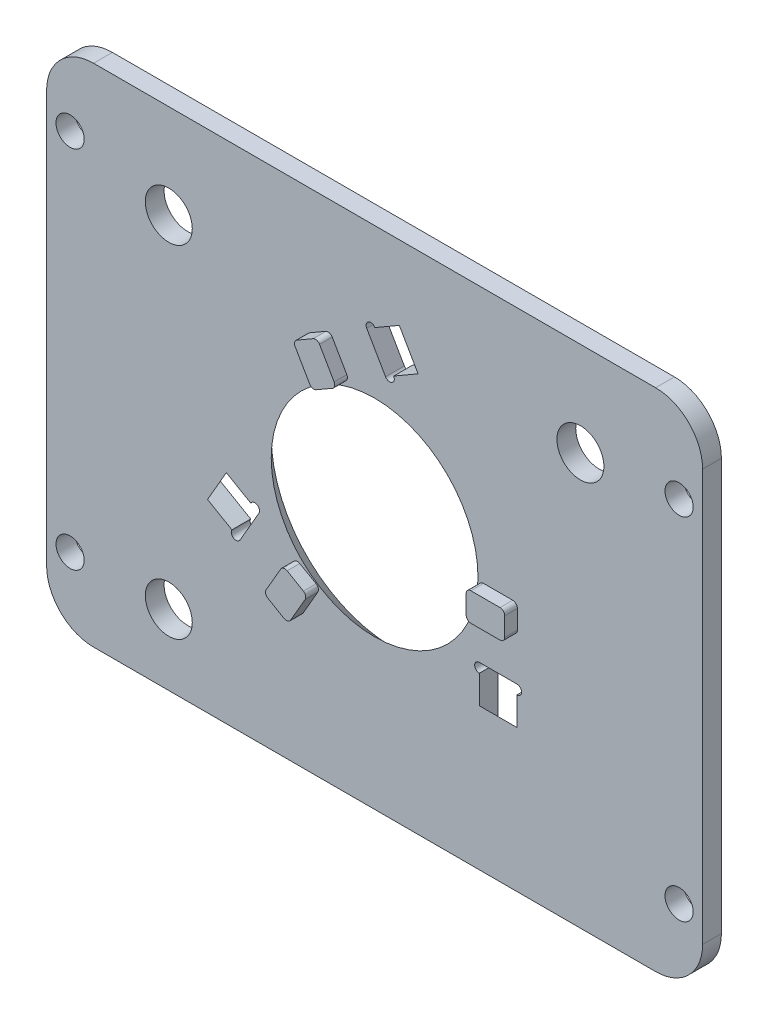
from build123d import *

# Parameters (mm, degrees)
SKETCH_1_W          = 76
SKETCH_1_H          = 60
EXTRUDE_1_DEPTH     = 2
EXTRUDE_2_DEPTH     = 3.35
SKETCH_2_W          = 76
SKETCH_2_H          = 60
CUT_EXTRUDE_1_DEPTH = 2.95
SKETCH_3_R          = 1.715
CUT_EXTRUDE_2_DEPTH = 10
SKETCH_5_R          = 1.5
CUT_EXTRUDE_3_DEPTH = 45.193605611
SKETCH_6_R          = 2.5
CUT_EXTRUDE_4_DEPTH = 45.111815616
CUT_EXTRUDE_5_DEPTH = 4
CUT_EXTRUDE_6_DEPTH = 4
CUT_EXTRUDE_7_DEPTH = 4


with BuildPart() as part:
    # 草圖1 → 填料-伸長1 (new body)
    with BuildSketch(Plane.XY):
        Rectangle(SKETCH_1_W, SKETCH_1_H)
        with BuildLine():
            Line((-6.042909564, -9.905650781), (-7.592909564, -12.590329533))
            ThreePointArc((-7.592909564, -12.590329533), (-7.896512744, -12.823292446), (-8.275922266, -12.773342235))
            Line((-8.275922266, -12.773342235), (-10.007973074, -11.773342235))
            ThreePointArc((-10.007973074, -11.773342235), (-10.240935987, -11.469739056), (-10.190985776, -11.090329533))
            Line((-10.190985776, -11.090329533), (-8.640985776, -8.405650781))
            ThreePointArc((-8.640985776, -8.405650781), (-8.337382596, -8.172687868), (-7.957973074, -8.22263808))
            Line((-7.957973074, -8.22263808), (-6.225922266, -9.22263808))
            ThreePointArc((-6.225922266, -9.22263808), (-5.992959353, -9.526241259), (-6.042909564, -9.905650781))
        make_face(mode=Mode.SUBTRACT)
        with BuildLine():
            ThreePointArc((-14.313100093, -9.230040965), (-14.996112795, -9.413053667), (-15.179125497, -8.730040965))
            Line((-15.179125497, -8.730040965), (-13.179125497, -5.26593935))
            ThreePointArc((-13.179125497, -5.26593935), (-12.496112795, -5.082926648), (-12.313100093, -5.76593935))
            Line((-12.313100093, -5.76593935), (-14.313100093, -9.230040965))
        make_face(mode=Mode.SUBTRACT)
        with BuildLine():
            ThreePointArc((11.146484837, -8.780487805), (10.646484837, -8.280487805), (11.146484837, -7.780487805))
            Line((11.146484837, -7.780487805), (15.146484837, -7.780487805))
            ThreePointArc((15.146484837, -7.780487805), (15.646484837, -8.280487805), (15.146484837, -8.780487805))
            Line((15.146484837, -8.780487805), (11.146484837, -8.780487805))
        make_face(mode=Mode.SUBTRACT)
        with BuildLine():
            Line((-5.557090436, 10.186138586), (-7.107090436, 12.870817338))
            ThreePointArc((-7.107090436, 12.870817338), (-7.157040647, 13.250226861), (-6.924077734, 13.55383004))
            Line((-6.924077734, 13.55383004), (-5.192026926, 14.55383004))
            ThreePointArc((-5.192026926, 14.55383004), (-4.812617404, 14.603780251), (-4.509014224, 14.370817338))
            Line((-4.509014224, 14.370817338), (-2.959014224, 11.686138586))
            ThreePointArc((-2.959014224, 11.686138586), (-2.909064013, 11.306729064), (-3.142026926, 11.003125884))
            Line((-3.142026926, 11.003125884), (-4.874077734, 10.003125884))
            ThreePointArc((-4.874077734, 10.003125884), (-5.253487256, 9.953175673), (-5.557090436, 10.186138586))
        make_face(mode=Mode.SUBTRACT)
        with BuildLine():
            Line((1.163100093, 13.546427155), (-0.836899907, 17.01052877))
            ThreePointArc((-0.836899907, 17.01052877), (-0.653887205, 17.693541472), (0.029125497, 17.51052877))
            Line((0.029125497, 17.51052877), (2.029125497, 14.046427155))
            ThreePointArc((2.029125497, 14.046427155), (1.846112795, 13.363414453), (1.163100093, 13.546427155))
        make_face(mode=Mode.SUBTRACT)
    extrude(amount=EXTRUDE_1_DEPTH)

    # 草圖1<3> → 填料-伸長2 (add)
    with BuildSketch(Plane.XY):
        with BuildLine():
            Line((14.696484837, -0.280487805), (11.596484837, -0.280487805))
            ThreePointArc((11.596484837, -0.280487805), (11.242931447, -0.426934414), (11.096484837, -0.780487805))
            Line((11.096484837, -0.780487805), (11.096484837, -2.780487805))
            ThreePointArc((11.096484837, -2.780487805), (11.242931447, -3.134041195), (11.596484837, -3.280487805))
            Line((11.596484837, -3.280487805), (14.696484837, -3.280487805))
            ThreePointArc((14.696484837, -3.280487805), (15.050038228, -3.134041195), (15.196484837, -2.780487805))
            Line((15.196484837, -2.780487805), (15.196484837, -0.780487805))
            ThreePointArc((15.196484837, -0.780487805), (15.050038228, -0.426934414), (14.696484837, -0.280487805))
        make_face()
        with BuildLine():
            Line((-7.592909564, -12.590329533), (-6.042909564, -9.905650781))
            ThreePointArc((-6.042909564, -9.905650781), (-5.992959353, -9.526241259), (-6.225922266, -9.22263808))
            Line((-6.225922266, -9.22263808), (-7.957973074, -8.22263808))
            ThreePointArc((-7.957973074, -8.22263808), (-8.337382596, -8.172687868), (-8.640985776, -8.405650781))
            Line((-8.640985776, -8.405650781), (-10.190985776, -11.090329533))
            ThreePointArc((-10.190985776, -11.090329533), (-10.240935987, -11.469739056), (-10.007973074, -11.773342235))
            Line((-10.007973074, -11.773342235), (-8.275922266, -12.773342235))
            ThreePointArc((-8.275922266, -12.773342235), (-7.896512744, -12.823292446), (-7.592909564, -12.590329533))
        make_face()
        with BuildLine():
            Line((-7.107090436, 12.870817338), (-5.557090436, 10.186138586))
            ThreePointArc((-5.557090436, 10.186138586), (-5.253487256, 9.953175673), (-4.874077734, 10.003125884))
            Line((-4.874077734, 10.003125884), (-3.142026926, 11.003125884))
            ThreePointArc((-3.142026926, 11.003125884), (-2.909064013, 11.306729064), (-2.959014224, 11.686138586))
            Line((-2.959014224, 11.686138586), (-4.509014224, 14.370817338))
            ThreePointArc((-4.509014224, 14.370817338), (-4.812617404, 14.603780251), (-5.192026926, 14.55383004))
            Line((-5.192026926, 14.55383004), (-6.924077734, 13.55383004))
            ThreePointArc((-6.924077734, 13.55383004), (-7.157040647, 13.250226861), (-7.107090436, 12.870817338))
        make_face()
    extrude(amount=EXTRUDE_2_DEPTH)

    # 草圖2 → 除料-伸長1 (cut)
    with BuildSketch(Plane(origin=(0, 0, 0), x_dir=(-1, 0, 0), z_dir=(0, 0, -1))):
        Rectangle(SKETCH_2_W, SKETCH_2_H)
        with BuildLine():
            ThreePointArc((-29.9, 26.904317068), (-33.435533906, 25.439850974), (-34.9, 21.904317068))
            Line((-34.9, 21.904317068), (-34.9, -21.9))
            ThreePointArc((-34.9, -21.9), (-33.435533906, -25.435533906), (-29.9, -26.9))
            Line((-29.9, -26.9), (29.9, -26.9))
            ThreePointArc((29.9, -26.9), (33.435533906, -25.435533906), (34.9, -21.9))
            Line((34.9, -21.9), (34.9, 21.904317068))
            ThreePointArc((34.9, 21.904317068), (33.435533906, 25.439850974), (29.9, 26.904317068))
            Line((29.9, 26.904317068), (-29.9, 26.904317068))
        make_face(mode=Mode.SUBTRACT)
    extrude(amount=-CUT_EXTRUDE_1_DEPTH, mode=Mode.SUBTRACT)

    # 草圖3 → 除料-伸長2 (cut)
    with BuildSketch(Plane(origin=(0, 0, 0), x_dir=(-1, 0, 0), z_dir=(0, 0, -1))):
        Circle(SKETCH_3_R)
    extrude(amount=-CUT_EXTRUDE_2_DEPTH, mode=Mode.SUBTRACT)

    # 草圖4 → 除料-旋轉1 (revolve, cut)
    with BuildSketch(Plane(origin=(0, 0, 0), x_dir=(1, 0, 0), z_dir=(0, 1, 0)), mode=Mode.PRIVATE) as cut_revolve_1_sk:
        Polygon((0, -2), (11, -2), (13, 0), (0, 0), align=None)
    revolve(cut_revolve_1_sk.sketch.rotate(Axis((0, 0, -2.897060396), (0, 0, 1)), 180), axis=Axis((0, 0, -2.897060396), (0, 0, 1)), mode=Mode.SUBTRACT)

    # 草圖5 → 除料-伸長3 (cut, through all)
    with BuildSketch(Plane.XY):
        with Locations((32.4, 17.904317068)):
            Circle(SKETCH_5_R)
        with Locations((-32.4, 19.404317068)):
            Circle(SKETCH_5_R)
        with Locations(Location((-32.4, -19.4, 0), (0, 0, 180))):
            Circle(SKETCH_5_R)
        with Locations((32.4, -19.4)):
            Circle(SKETCH_5_R)
    extrude(amount=CUT_EXTRUDE_3_DEPTH, mode=Mode.SUBTRACT)

    # 草圖6 → 除料-伸長4 (cut, through all)
    with BuildSketch(Plane.XY.offset(2)):
        with Locations((-21.9, 16.904317068)):
            Circle(SKETCH_6_R)
        with Locations(Location((21.9, 16.904317068, 0), (0, 0, 180))):
            Circle(SKETCH_6_R)
        with Locations((-21.9, -19.4)):
            Circle(SKETCH_6_R)
    extrude(amount=-CUT_EXTRUDE_4_DEPTH, mode=Mode.SUBTRACT)

    # 草圖7 → 除料-伸長5 (cut)
    with BuildSketch(Plane.ZY.offset(-11.146484837)):
        Polygon((2, -8.780487805), (2, -11.780487805), (0, -13.780487805), (0, -8.780487805), align=None)
    extrude(amount=-CUT_EXTRUDE_5_DEPTH, mode=Mode.SUBTRACT)

    # 草圖8 → 除料-伸長6 (cut)
    with BuildSketch(Plane(origin=(-5.575, -9.656183252, 0), x_dir=(0.8660254037844398, -0.499999999999998, 0), z_dir=(0.49999999999999806, 0.8660254037844399, 0))):
        Polygon((-8.780487805, -2), (-8.780487805, 0), (-13.780487805, 0), (-11.780487805, -2), align=None)
    extrude(amount=-CUT_EXTRUDE_6_DEPTH, mode=Mode.SUBTRACT)

    # 草圖9 → 除料-伸長7 (cut)
    with BuildSketch(Plane(origin=(-5.575, 9.656183252, 0), x_dir=(-0.8660254037844397, -0.49999999999999806, 0), z_dir=(0.49999999999999806, -0.8660254037844397, 0))):
        Polygon((-8.780487805, -2), (-8.780487805, 0), (-13.780487805, 0), (-11.780487805, -2), align=None)
    extrude(amount=-CUT_EXTRUDE_7_DEPTH, mode=Mode.SUBTRACT)


solid = part.part
